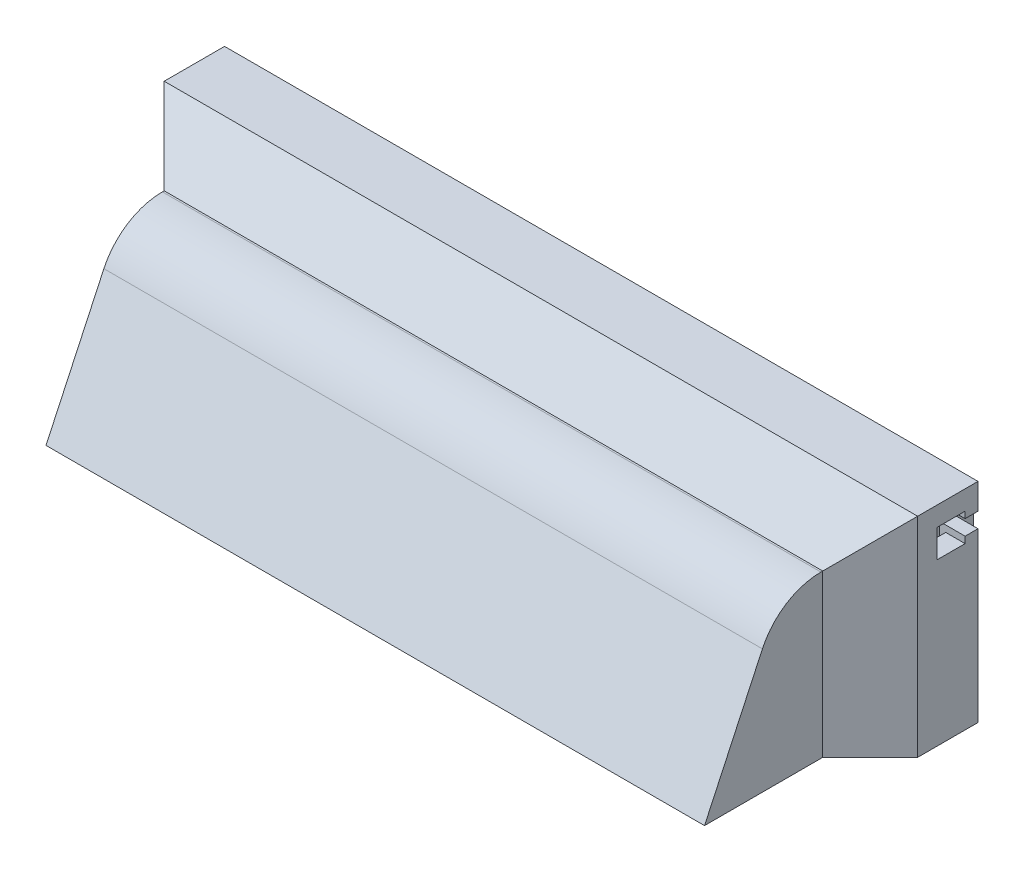
from build123d import *

# Parameters (mm, degrees)
SKETCH1_W           = 102
SKETCH1_H           = 30
BOSS_EXTRUDE1_DEPTH = 25
CUT_EXTRUDE1_DEPTH  = 21
BOSS_EXTRUDE2_DEPTH = 102
SKETCH4_R           = 6.05
CUT_EXTRUDE2_DEPTH  = 3.5
FILLET1_R           = 10
CUT_EXTRUDE3_DEPTH  = 23.5
SKETCH6_W           = 1
SKETCH6_H           = 2
BOSS_EXTRUDE3_DEPTH = 25
SKETCH7_W           = 2
SKETCH7_H           = 1
BOSS_EXTRUDE4_DEPTH = 116.7
CUT_EXTRUDE4_DEPTH  = 7.35
SKETCH9_W           = 2.35
SKETCH9_H           = 1
SKETCH9_W_2         = 12
CUT_EXTRUDE5_DEPTH  = 3


with BuildPart() as part:
    # Sketch1 → Boss-Extrude1 (new body)
    with BuildSketch(Plane(origin=(0, 0, 0), x_dir=(1, 0, 0), z_dir=(0, 1, 0))):
        Rectangle(SKETCH1_W, SKETCH1_H)
    extrude(amount=BOSS_EXTRUDE1_DEPTH)

    # Sketch2 → Cut-Extrude1 (cut)
    with BuildSketch(Plane.XZ):
        with BuildLine():
            Line((-46, -37), (46, -37))
            Line((46, -37), (46, 5))
            ThreePointArc((46, 5), (45.414213562, 6.414213562), (44, 7))
            Line((44, 7), (-44, 7))
            ThreePointArc((-44, 7), (-45.414213562, 6.414213562), (-46, 5))
            Line((-46, 5), (-46, -37))
        make_face()
    extrude(amount=-CUT_EXTRUDE1_DEPTH, mode=Mode.SUBTRACT)

    # Sketch3 → Boss-Extrude2 (add)
    with BuildSketch(Plane(origin=(51, 0, 0), x_dir=(0, 0, -1), z_dir=(1, 0, 0))):
        Polygon((-15, 25), (-26.657691454, 0), (-15, 0), align=None)
    extrude(amount=-BOSS_EXTRUDE2_DEPTH)

    # Sketch4 → Cut-Extrude2 (cut)
    with BuildSketch(Plane.XZ):
        with Locations(Location((-30, 17, 0), (0, 0, 270))):
            Circle(SKETCH4_R)
        with Locations(Location((30, 17, 0), (0, 0, 270))):
            Circle(SKETCH4_R)
    extrude(amount=-CUT_EXTRUDE2_DEPTH, mode=Mode.SUBTRACT)

    # Fillet1
    fillet1_edges = [part.edges().sort_by_distance(p)[0] for p in [
        (0, 25, 15),
    ]]
    fillet(fillet1_edges, radius=FILLET1_R)

    # Sketch5 → Cut-Extrude3 (cut)
    with BuildSketch(Plane(origin=(0, 25, 0), x_dir=(1, 0, 0), z_dir=(0, 1, 0))):
        with BuildLine():
            Line((-24, 26), (-24, 4))
            ThreePointArc((-24, 4), (-30, -2), (-36, 4))
            Line((-36, 4), (-36, 26))
            ThreePointArc((-36, 26), (-30, 32), (-24, 26))
        make_face()
        with BuildLine():
            Line((24, 4), (24, 26))
            ThreePointArc((24, 26), (30, 32), (36, 26))
            Line((36, 26), (36, 4))
            ThreePointArc((36, 4), (30, -2), (24, 4))
        make_face()
    extrude(amount=-CUT_EXTRUDE3_DEPTH, mode=Mode.SUBTRACT)

    # Sketch6 → Boss-Extrude3 (add)
    with BuildSketch(Plane.XZ):
        Polygon((51, -2), (55.35, -2), (55.35, -6.35), (54.35, -6.35), (54.35, -8.35), (58.35, -8.35), (58.35, 1), (51, 8.35), align=None)
        with Locations((51.5, -7.35)):
            Rectangle(SKETCH6_W, SKETCH6_H)
    boss_extrude3 = extrude(amount=-BOSS_EXTRUDE3_DEPTH)

    # Sketch7 → Boss-Extrude4 (add)
    with BuildSketch(Plane(origin=(58.35, 0, 0), x_dir=(0, 0, -1), z_dir=(1, 0, 0))):
        Polygon((2, 25), (2, 29.35), (6.35, 29.35), (6.35, 28.35), (8.35, 28.35), (8.35, 32.35), (-1, 32.35), (-8.35, 25), align=None)
        with Locations((7.35, 25.5)):
            Rectangle(SKETCH7_W, SKETCH7_H)
    extrude(amount=-BOSS_EXTRUDE4_DEPTH)

    # Sketch8 → Cut-Extrude4 (cut)
    with BuildSketch(Plane.XZ.offset(-25)):
        Polygon((58.35, 8.35), (51, 8.35), (58.35, 1), align=None)
    cut_extrude4 = extrude(amount=-CUT_EXTRUDE4_DEPTH, mode=Mode.SUBTRACT)

    # Mirror1: Boss-Extrude3, Cut-Extrude4 across plane
    add(boss_extrude3.mirror(Plane(origin=(0, 0, 0), x_dir=(0, 0, 1), z_dir=(1, 0, 0))))
    add(cut_extrude4.mirror(Plane(origin=(0, 0, 0), x_dir=(0, 0, 1), z_dir=(1, 0, 0))), mode=Mode.SUBTRACT)

    # Sketch9 → Cut-Extrude5 (cut)
    with BuildSketch(Plane(origin=(0, 0, -8.35), x_dir=(-1, 0, 0), z_dir=(0, 0, -1))):
        with Locations((-53.175, 25.5)):
            Rectangle(SKETCH9_W, SKETCH9_H)
        with Locations((-30, 25.5)):
            Rectangle(SKETCH9_W_2, SKETCH9_H)
        with Locations((53.175, 25.5)):
            Rectangle(SKETCH9_W, SKETCH9_H)
        with Locations((30, 25.5)):
            Rectangle(SKETCH9_W_2, SKETCH9_H)
    extrude(amount=-CUT_EXTRUDE5_DEPTH, mode=Mode.SUBTRACT)


solid = part.part
